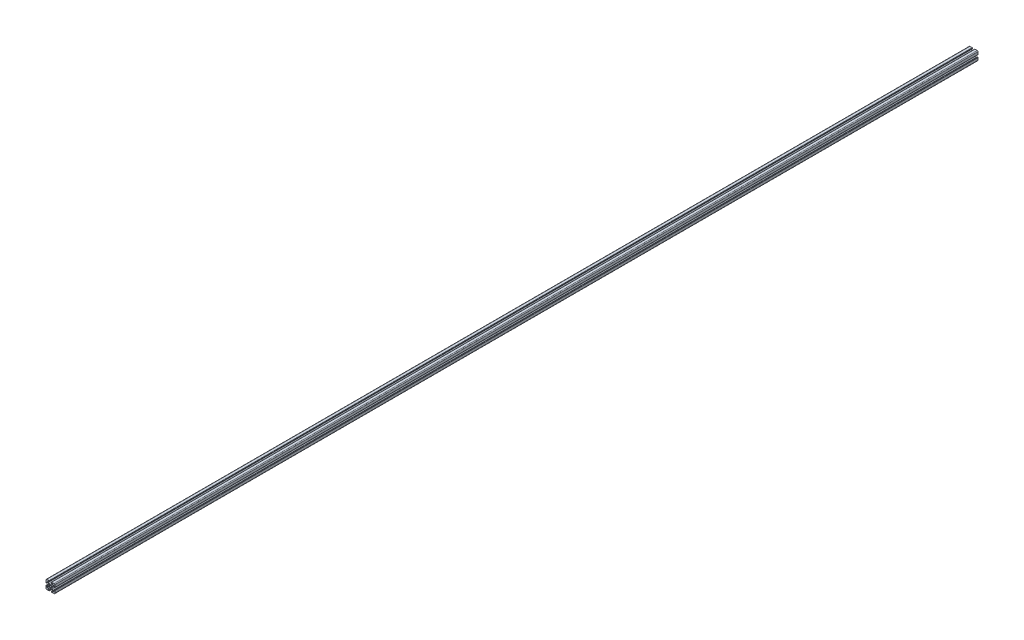
from build123d import *

# Parameters (mm, degrees)
BOSS_EXTRUDE1_DEPTH = 1050


with BuildPart() as part:
    # Sketch4 → Boss-Extrude1 (new, symmetric)
    with BuildSketch(Plane.XY):
        with BuildLine():
            Line((3, -10), (8.25, -10))
            ThreePointArc((8.25, -10), (9.487436867, -9.487436867), (10, -8.25))
            Line((10, -8.25), (10, -3))
            ThreePointArc((10, -3), (9.853553391, -2.646446609), (9.5, -2.5))
            Line((9.5, -2.5), (8.424621202, -2.5))
            ThreePointArc((8.424621202, -2.5), (8.071067812, -2.646446609), (7.924621202, -3))
            Line((7.924621202, -3), (7.924621202, -5.25))
            ThreePointArc((7.924621202, -5.25), (7.615962919, -5.711939766), (7.071067812, -5.603553391))
            Line((7.071067812, -5.603553391), (4.478679656, -3.011165235))
            ThreePointArc((4.478679656, -3.011165235), (3.828361402, -2.037895189), (3.6, -0.889844892))
            Line((3.6, -0.889844892), (3.6, 0))
            Line((3.6, 0), (2.15, 0))
            ThreePointArc((2.15, 0), (1.52027958, -1.52027958), (0, -2.15))
            Line((0, -2.15), (0, -3.6))
            Line((0, -3.6), (0.889844892, -3.6))
            ThreePointArc((0.889844892, -3.6), (2.037895189, -3.828361402), (3.011165235, -4.478679656))
            Line((3.011165235, -4.478679656), (5.603553391, -7.071067812))
            ThreePointArc((5.603553391, -7.071067812), (5.711939766, -7.615962919), (5.25, -7.924621202))
            Line((5.25, -7.924621202), (3, -7.924621202))
            ThreePointArc((3, -7.924621202), (2.646446609, -8.071067812), (2.5, -8.424621202))
            Line((2.5, -8.424621202), (2.5, -9.5))
            ThreePointArc((2.5, -9.5), (2.646446609, -9.853553391), (3, -10))
        make_face()
    extrude(amount=BOSS_EXTRUDE1_DEPTH, both=True)

    # Mirror1: part across plane


with BuildPart() as part_1:
    add(part.part)
    add(part.part.mirror(Plane(origin=(0, 0, 0), x_dir=(0, 0, 1), z_dir=(1, 0, 0))))

    # Mirror2: part across plane


with BuildPart() as part_2:
    add(part_1.part)
    add(part_1.part.mirror(Plane.ZX))


solid = part_2.part
